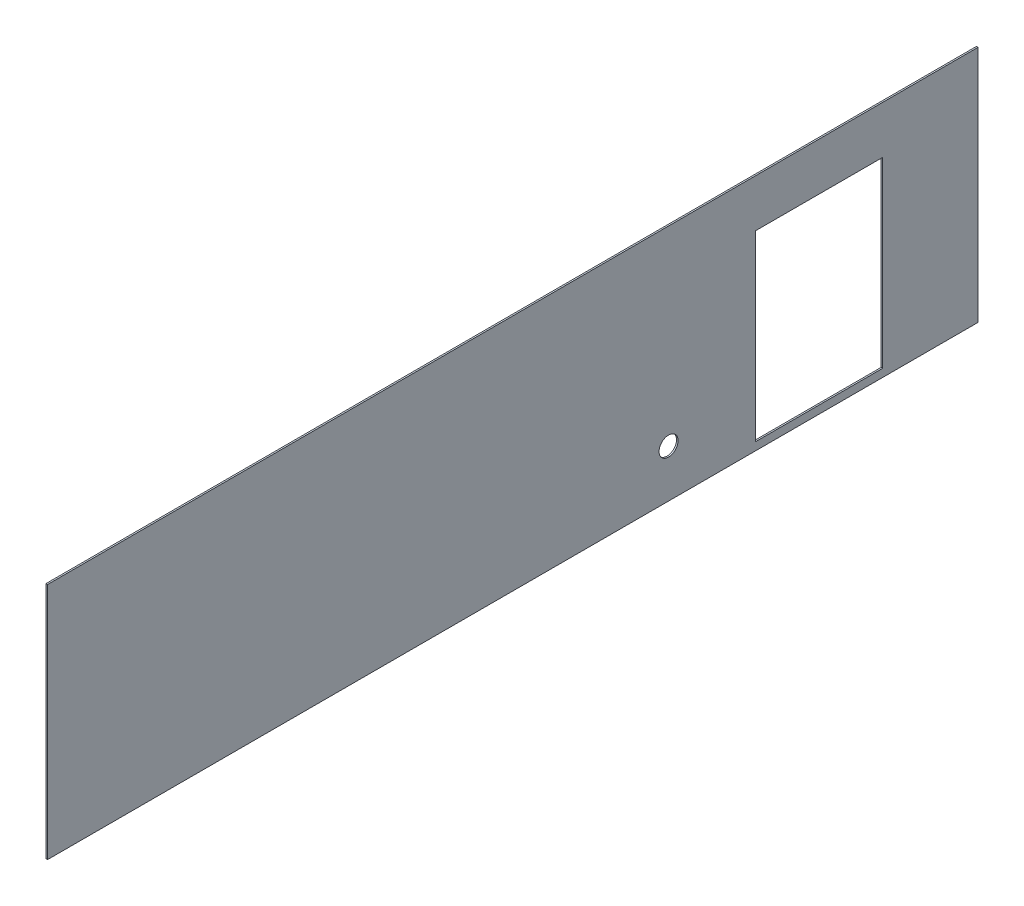
from build123d import *

# Parameters (mm, degrees)
SKETCH1_W           = 473.075
SKETCH1_H           = 95.25
BOSS_EXTRUDE1_DEPTH = 3.175
SKETCH3_W           = 78.74
SKETCH3_H           = 51.308
CUT_EXTRUDE2_DEPTH  = 242.305221983
SKETCH4_R           = 8.255
CUT_EXTRUDE3_DEPTH  = 242.305221983
SKETCH5_R           = 1.5875
CUT_EXTRUDE4_DEPTH  = 242.305221983
SKETCH6_W           = 3.175
SKETCH6_H           = 95.25
BOSS_EXTRUDE2_DEPTH = 371.948016105
SKETCH7_R           = 3.81
SKETCH7_W           = 50.8
SKETCH7_H           = 73.025
CUT_EXTRUDE5_DEPTH  = 381
CUT_EXTRUDE6_DEPTH  = 381
SKETCH12_W          = 371.948016105
SKETCH12_H          = 95.25
CUT_EXTRUDE7_DEPTH  = 2.54
SKETCH14_W          = 473.075
SKETCH14_H          = 95.25
CUT_EXTRUDE8_DEPTH  = 3.175


with BuildPart() as part:
    # Sketch1 → Boss-Extrude1 (new body)
    with BuildSketch(Plane.XY):
        Rectangle(SKETCH1_W, SKETCH1_H)
    extrude(amount=BOSS_EXTRUDE1_DEPTH)

    # Sketch3 → Cut-Extrude2 (cut, through all)
    with BuildSketch(Plane.XY.offset(3.175)):
        with Locations((0, 6.731)):
            Rectangle(SKETCH3_W, SKETCH3_H)
    extrude(amount=-CUT_EXTRUDE2_DEPTH, mode=Mode.SUBTRACT)

    # Sketch4 → Cut-Extrude3 (cut, through all)
    with BuildSketch(Plane.XY.offset(3.175)):
        with Locations((37.592, -35.814)):
            Circle(SKETCH4_R)
    extrude(amount=-CUT_EXTRUDE3_DEPTH, mode=Mode.SUBTRACT)

    # Sketch5 → Cut-Extrude4 (cut, through all)
    with BuildSketch(Plane.XY.offset(3.175)):
        with Locations((-44.196, 40.259)):
            Circle(SKETCH5_R)
        with Locations((44.196, 40.259)):
            Circle(SKETCH5_R)
        with Locations((-44.196, -24.765)):
            Circle(SKETCH5_R)
        with Locations((44.196, -24.765)):
            Circle(SKETCH5_R)
    extrude(amount=-CUT_EXTRUDE4_DEPTH, mode=Mode.SUBTRACT)

    # Sketch6 → Boss-Extrude2 (add)
    with BuildSketch(Plane(origin=(0, 0, 0), x_dir=(-1, 0, 0), z_dir=(0, 0, -1))):
        with Locations((234.95, 0)):
            Rectangle(SKETCH6_W, SKETCH6_H)
    extrude(amount=BOSS_EXTRUDE2_DEPTH)

    # Sketch7 → Cut-Extrude5 (cut)
    with BuildSketch(Plane.ZY.offset(236.5375)):
        with Locations((-248.250016105, -28.575)):
            Circle(SKETCH7_R)
        with Locations((-308.448016105, -7.9375)):
            Rectangle(SKETCH7_W, SKETCH7_H)
    extrude(amount=-CUT_EXTRUDE5_DEPTH, mode=Mode.SUBTRACT)

    # Sketch8 → Cut-Extrude6 (cut)
    with BuildSketch(Plane.XY.offset(3.175)):
        with BuildLine():
            Line((88.9, 31.75), (215.9, 31.75))
            ThreePointArc((215.9, 31.75), (219.71, 27.94), (215.9, 24.13))
            Line((215.9, 24.13), (88.9, 24.13))
            ThreePointArc((88.9, 24.13), (85.09, 27.94), (88.9, 31.75))
        make_face()
        with BuildLine():
            Line((88.9, 12.563594852), (215.9, 12.563594852))
            ThreePointArc((215.9, 12.563594852), (219.71, 8.753594852), (215.9, 4.943594852))
            Line((215.9, 4.943594852), (88.9, 4.943594852))
            ThreePointArc((88.9, 4.943594852), (85.09, 8.753594852), (88.9, 12.563594852))
        make_face()
        with BuildLine():
            Line((88.9, -6.256272006), (215.9, -6.256272006))
            ThreePointArc((215.9, -6.256272006), (219.71, -10.066272006), (215.9, -13.876272006))
            Line((215.9, -13.876272006), (88.9, -13.876272006))
            ThreePointArc((88.9, -13.876272006), (85.09, -10.066272006), (88.9, -6.256272006))
        make_face()
        with BuildLine():
            Line((88.9, -24.84600572), (215.9, -24.84600572))
            ThreePointArc((215.9, -24.84600572), (219.71, -28.65600572), (215.9, -32.46600572))
            Line((215.9, -32.46600572), (88.9, -32.46600572))
            ThreePointArc((88.9, -32.46600572), (85.09, -28.65600572), (88.9, -24.84600572))
        make_face()
        with BuildLine():
            Line((-88.9, -24.84600572), (-215.9, -24.84600572))
            ThreePointArc((-215.9, -24.84600572), (-219.71, -28.65600572), (-215.9, -32.46600572))
            Line((-215.9, -32.46600572), (-88.9, -32.46600572))
            ThreePointArc((-88.9, -32.46600572), (-85.09, -28.65600572), (-88.9, -24.84600572))
        make_face()
        with BuildLine():
            Line((-88.9, -6.256272006), (-215.9, -6.256272006))
            ThreePointArc((-215.9, -6.256272006), (-219.71, -10.066272006), (-215.9, -13.876272006))
            Line((-215.9, -13.876272006), (-88.9, -13.876272006))
            ThreePointArc((-88.9, -13.876272006), (-85.09, -10.066272006), (-88.9, -6.256272006))
        make_face()
        with BuildLine():
            Line((-88.9, 12.563594852), (-215.9, 12.563594852))
            ThreePointArc((-215.9, 12.563594852), (-219.71, 8.753594852), (-215.9, 4.943594852))
            Line((-215.9, 4.943594852), (-88.9, 4.943594852))
            ThreePointArc((-88.9, 4.943594852), (-85.09, 8.753594852), (-88.9, 12.563594852))
        make_face()
        with BuildLine():
            Line((-88.9, 31.75), (-215.9, 31.75))
            ThreePointArc((-215.9, 31.75), (-219.71, 27.94), (-215.9, 24.13))
            Line((-215.9, 24.13), (-88.9, 24.13))
            ThreePointArc((-88.9, 24.13), (-85.09, 27.94), (-88.9, 31.75))
        make_face()
    extrude(amount=-CUT_EXTRUDE6_DEPTH, mode=Mode.SUBTRACT)

    # Sketch12 → Cut-Extrude7 (cut)
    with BuildSketch(Plane(origin=(-233.3625, 0, 0), x_dir=(0, 0, -1), z_dir=(1, 0, 0))):
        with Locations((185.974008053, 0)):
            Rectangle(SKETCH12_W, SKETCH12_H)
    extrude(amount=-CUT_EXTRUDE7_DEPTH, mode=Mode.SUBTRACT)

    # Sketch14 → Cut-Extrude8 (cut)
    with BuildSketch(Plane.XY.offset(3.175)):
        Rectangle(SKETCH14_W, SKETCH14_H)
    extrude(amount=-CUT_EXTRUDE8_DEPTH, mode=Mode.SUBTRACT)


solid = part.part
